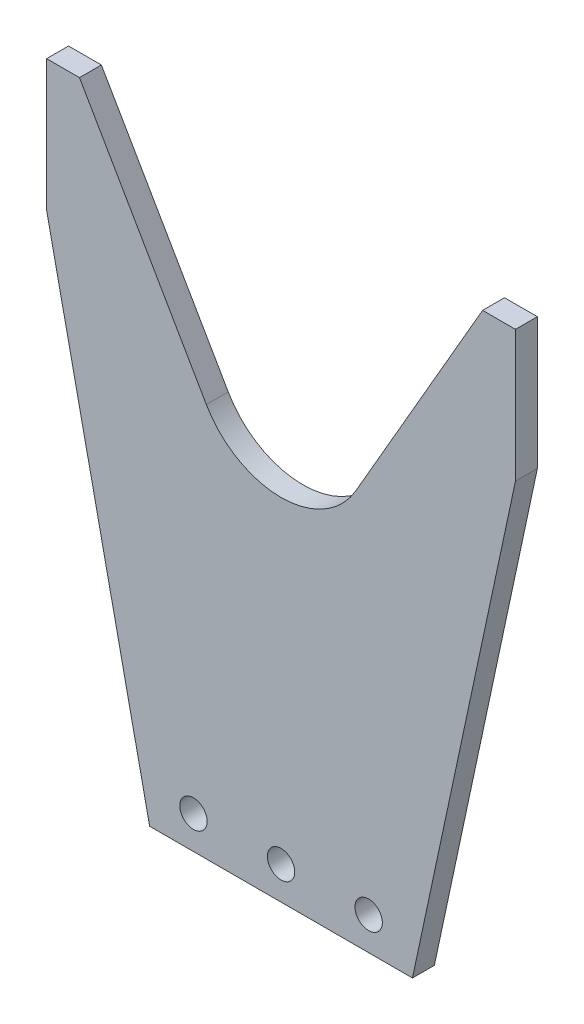
from build123d import *

# Parameters (mm, degrees)
BOSS_EXTRUDE1_DEPTH            = 6.35
F_5_16_0_3125_DIAMETER_HOLE1_D = 7.9375


with BuildPart() as part:
    # Sketch1 → Boss-Extrude1 (new body)
    with BuildSketch(Plane.XY):
        with BuildLine():
            Line((-21.667089577, -12.5095), (-58.438816897, 51.181))
            Line((-58.438816897, 51.181), (-67.963816897, 51.181))
            Line((-67.963816897, 51.181), (-67.963816897, 13.081))
            Line((-67.963816897, 13.081), (-38.1, -126.619))
            Line((-38.1, -126.619), (38.1, -126.619))
            Line((38.1, -126.619), (67.963816897, 13.081))
            Line((67.963816897, 13.081), (67.963816897, 51.181))
            Line((67.963816897, 51.181), (58.438816897, 51.181))
            Line((58.438816897, 51.181), (21.667089577, -12.5095))
            ThreePointArc((21.667089577, -12.5095), (0, -25.019), (-21.667089577, -12.5095))
        make_face()
    extrude(amount=BOSS_EXTRUDE1_DEPTH)

    # 5/16 (0.3125) Diameter Hole1 (through all)
    with Locations(Plane.XY.offset(6.35)):
        with Locations((-25.4, -117.094), (25.4, -117.094), (0, -117.094)):
            Hole(F_5_16_0_3125_DIAMETER_HOLE1_D / 2)


solid = part.part
